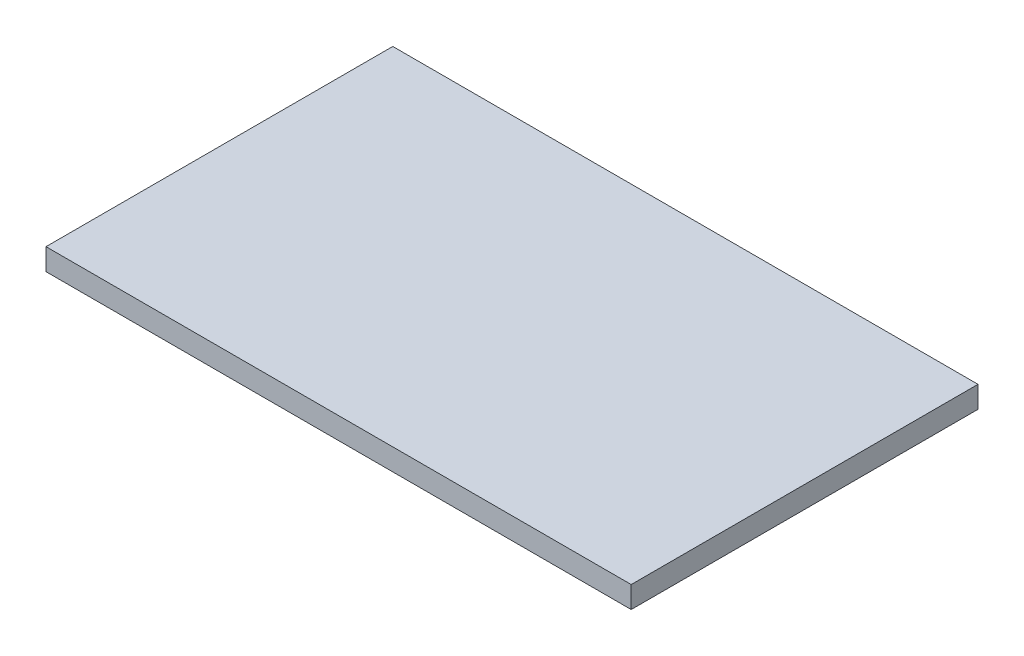
from build123d import *

# Parameters (mm, degrees)
SKETCH_1_W      = 270
SKETCH_1_H      = 10
EXTRUDE_1_DEPTH = 160


with BuildPart() as part:
    # 草图1 → 凸台-拉伸1 (new body)
    with BuildSketch(Plane.XY):
        Rectangle(SKETCH_1_W, SKETCH_1_H)
    extrude(amount=EXTRUDE_1_DEPTH)


solid = part.part
